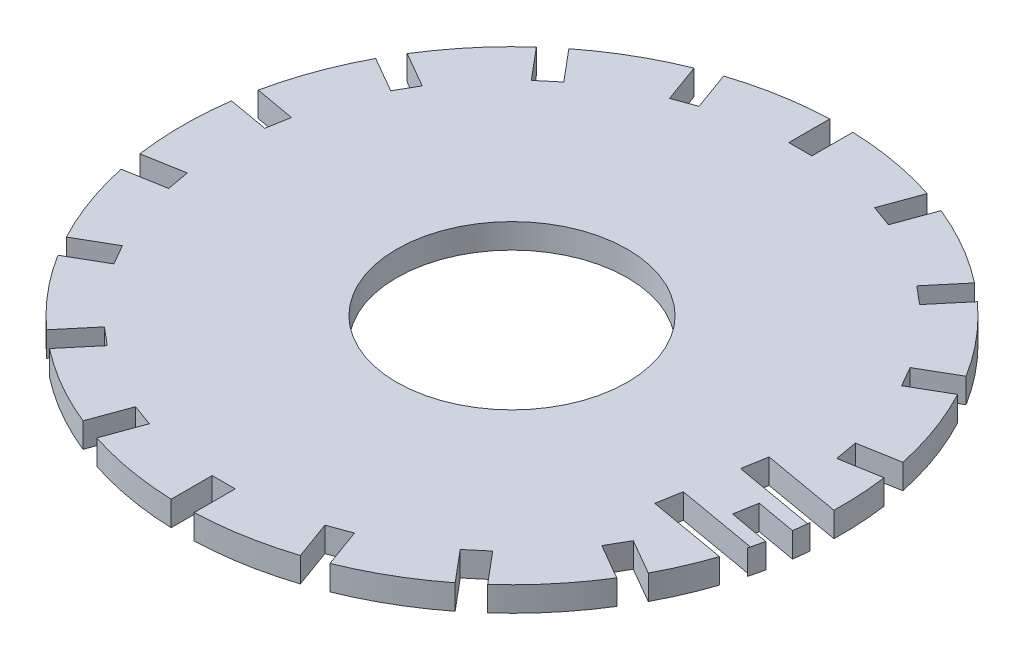
from build123d import *

# Parameters (mm, degrees)
ESQUISSE1_R             = 40
ESQUISSE1_R_2           = 14
BOSS_EXTRU_1_DEPTH      = 3
ENL_V_MAT_EXTRU_1_REACH = 58.648
ESQUISSE2_W             = 2.8
ESQUISSE2_H             = 5
ENL_V_MAT_EXTRU_2_DEPTH = 10


with BuildPart() as part:
    # Esquisse1 → Boss.-Extru.1 (new body)
    with BuildSketch(Plane(origin=(0, 0, 0), x_dir=(1, 0, 0), z_dir=(0, 1, 0))):
        with Locations(Location((0, 0, 0), (0, 0, 270))):
            Circle(ESQUISSE1_R)
        with Locations(Location((0, 0, 0), (0, 0, 270))):
            Circle(ESQUISSE1_R_2, mode=Mode.SUBTRACT)
    extrude(amount=BOSS_EXTRU_1_DEPTH)

    # Esquisse2 → Enlèv. mat.-Extru.1 (cut, up to next)
    with BuildSketch(Plane(origin=(0, 3, 0), x_dir=(1, 0, 0), z_dir=(0, 1, 0)), mode=Mode.PRIVATE) as enl_v_mat_extru_1_sk1:
        Polygon((14.996375402, 37.108876631), (13.286274685, 32.410413527), (10.655135347, 33.368069928), (12.365236064, 38.066533032), align=None)
    enl_v_mat_extru_1_tool1 = extrude(enl_v_mat_extru_1_sk1.sketch, amount=-ENL_V_MAT_EXTRU_1_REACH, mode=Mode.PRIVATE) & part.part
    # Esquisse2 → Enlèv. mat.-Extru.1 (cut, up to next)
    with BuildSketch(Plane(origin=(0, 3, 0), x_dir=(1, 0, 0), z_dir=(0, 1, 0)), mode=Mode.PRIVATE) as enl_v_mat_extru_1_sk2:
        with Locations((0, 37.5)):
            Rectangle(ESQUISSE2_W, ESQUISSE2_H)
    enl_v_mat_extru_1_tool2 = extrude(enl_v_mat_extru_1_sk2.sketch, amount=-ENL_V_MAT_EXTRU_1_REACH, mode=Mode.PRIVATE) & part.part
    # Esquisse2 → Enlèv. mat.-Extru.1 (cut, up to next)
    with BuildSketch(Plane(origin=(0, 3, 0), x_dir=(1, 0, 0), z_dir=(0, 1, 0)), mode=Mode.PRIVATE) as enl_v_mat_extru_1_sk3:
        Polygon((26.783966608, 29.741875071), (23.570028559, 25.911652856), (21.425104119, 27.711458163), (24.639042167, 31.541680378), align=None)
    enl_v_mat_extru_1_tool3 = extrude(enl_v_mat_extru_1_sk3.sketch, amount=-ENL_V_MAT_EXTRU_1_REACH, mode=Mode.PRIVATE) & part.part
    # Esquisse2 → Enlèv. mat.-Extru.1 (cut, up to next)
    with BuildSketch(Plane(origin=(0, 3, 0), x_dir=(1, 0, 0), z_dir=(0, 1, 0)), mode=Mode.PRIVATE) as enl_v_mat_extru_1_sk4:
        Polygon((35.341016151, 18.787564435), (31.010889132, 16.287564435), (29.610889132, 18.712435565), (33.941016151, 21.212435565), align=None)
    enl_v_mat_extru_1_tool4 = extrude(enl_v_mat_extru_1_sk4.sketch, amount=-ENL_V_MAT_EXTRU_1_REACH, mode=Mode.PRIVATE) & part.part
    # Esquisse2 → Enlèv. mat.-Extru.1 (cut, up to next)
    with BuildSketch(Plane(origin=(0, 3, 0), x_dir=(1, 0, 0), z_dir=(0, 1, 0)), mode=Mode.PRIVATE) as enl_v_mat_extru_1_sk5:
        Polygon((39.635417569, 5.567196252), (34.711378804, 4.698955364), (34.225163907, 7.456417073), (39.149202672, 8.324657961), align=None)
    enl_v_mat_extru_1_tool5 = extrude(enl_v_mat_extru_1_sk5.sketch, amount=-ENL_V_MAT_EXTRU_1_REACH, mode=Mode.PRIVATE) & part.part
    # Esquisse2 → Enlèv. mat.-Extru.1 (cut, up to next)
    with BuildSketch(Plane(origin=(0, 3, 0), x_dir=(1, 0, 0), z_dir=(0, 1, 0)), mode=Mode.PRIVATE) as enl_v_mat_extru_1_sk6:
        Polygon((39.149202672, -8.324657961), (34.225163907, -7.456417073), (34.711378804, -4.698955364), (39.635417569, -5.567196252), align=None)
    enl_v_mat_extru_1_tool6 = extrude(enl_v_mat_extru_1_sk6.sketch, amount=-ENL_V_MAT_EXTRU_1_REACH, mode=Mode.PRIVATE) & part.part
    # Esquisse2 → Enlèv. mat.-Extru.1 (cut, up to next)
    with BuildSketch(Plane(origin=(0, 3, 0), x_dir=(1, 0, 0), z_dir=(0, 1, 0)), mode=Mode.PRIVATE) as enl_v_mat_extru_1_sk7:
        Polygon((33.941016151, -21.212435565), (29.610889132, -18.712435565), (31.010889132, -16.287564435), (35.341016151, -18.787564435), align=None)
    enl_v_mat_extru_1_tool7 = extrude(enl_v_mat_extru_1_sk7.sketch, amount=-ENL_V_MAT_EXTRU_1_REACH, mode=Mode.PRIVATE) & part.part
    # Esquisse2 → Enlèv. mat.-Extru.1 (cut, up to next)
    with BuildSketch(Plane(origin=(0, 3, 0), x_dir=(1, 0, 0), z_dir=(0, 1, 0)), mode=Mode.PRIVATE) as enl_v_mat_extru_1_sk8:
        Polygon((24.639042167, -31.541680378), (21.425104119, -27.711458163), (23.570028559, -25.911652856), (26.783966608, -29.741875071), align=None)
    enl_v_mat_extru_1_tool8 = extrude(enl_v_mat_extru_1_sk8.sketch, amount=-ENL_V_MAT_EXTRU_1_REACH, mode=Mode.PRIVATE) & part.part
    # Esquisse2 → Enlèv. mat.-Extru.1 (cut, up to next)
    with BuildSketch(Plane(origin=(0, 3, 0), x_dir=(1, 0, 0), z_dir=(0, 1, 0)), mode=Mode.PRIVATE) as enl_v_mat_extru_1_sk9:
        Polygon((12.365236064, -38.066533032), (10.655135347, -33.368069928), (13.286274686, -32.410413527), (14.996375402, -37.108876631), align=None)
    enl_v_mat_extru_1_tool9 = extrude(enl_v_mat_extru_1_sk9.sketch, amount=-ENL_V_MAT_EXTRU_1_REACH, mode=Mode.PRIVATE) & part.part
    # Esquisse2 → Enlèv. mat.-Extru.1 (cut, up to next)
    with BuildSketch(Plane(origin=(0, 3, 0), x_dir=(1, 0, 0), z_dir=(0, 1, 0)), mode=Mode.PRIVATE) as enl_v_mat_extru_1_sk10:
        with Locations((0, -37.5)):
            Rectangle(ESQUISSE2_W, ESQUISSE2_H)
    enl_v_mat_extru_1_tool10 = extrude(enl_v_mat_extru_1_sk10.sketch, amount=-ENL_V_MAT_EXTRU_1_REACH, mode=Mode.PRIVATE) & part.part
    # Esquisse2 → Enlèv. mat.-Extru.1 (cut, up to next)
    with BuildSketch(Plane(origin=(0, 3, 0), x_dir=(1, 0, 0), z_dir=(0, 1, 0)), mode=Mode.PRIVATE) as enl_v_mat_extru_1_sk11:
        Polygon((-14.996375402, -37.108876631), (-13.286274685, -32.410413527), (-10.655135347, -33.368069928), (-12.365236064, -38.066533032), align=None)
    enl_v_mat_extru_1_tool11 = extrude(enl_v_mat_extru_1_sk11.sketch, amount=-ENL_V_MAT_EXTRU_1_REACH, mode=Mode.PRIVATE) & part.part
    # Esquisse2 → Enlèv. mat.-Extru.1 (cut, up to next)
    with BuildSketch(Plane(origin=(0, 3, 0), x_dir=(1, 0, 0), z_dir=(0, 1, 0)), mode=Mode.PRIVATE) as enl_v_mat_extru_1_sk12:
        Polygon((-26.783966608, -29.741875071), (-23.570028559, -25.911652856), (-21.425104119, -27.711458163), (-24.639042167, -31.541680378), align=None)
    enl_v_mat_extru_1_tool12 = extrude(enl_v_mat_extru_1_sk12.sketch, amount=-ENL_V_MAT_EXTRU_1_REACH, mode=Mode.PRIVATE) & part.part
    # Esquisse2 → Enlèv. mat.-Extru.1 (cut, up to next)
    with BuildSketch(Plane(origin=(0, 3, 0), x_dir=(1, 0, 0), z_dir=(0, 1, 0)), mode=Mode.PRIVATE) as enl_v_mat_extru_1_sk13:
        Polygon((-35.341016151, -18.787564435), (-31.010889132, -16.287564435), (-29.610889132, -18.712435565), (-33.941016151, -21.212435565), align=None)
    enl_v_mat_extru_1_tool13 = extrude(enl_v_mat_extru_1_sk13.sketch, amount=-ENL_V_MAT_EXTRU_1_REACH, mode=Mode.PRIVATE) & part.part
    # Esquisse2 → Enlèv. mat.-Extru.1 (cut, up to next)
    with BuildSketch(Plane(origin=(0, 3, 0), x_dir=(1, 0, 0), z_dir=(0, 1, 0)), mode=Mode.PRIVATE) as enl_v_mat_extru_1_sk14:
        Polygon((-39.635417569, -5.567196252), (-34.711378804, -4.698955364), (-34.225163907, -7.456417073), (-39.149202672, -8.324657961), align=None)
    enl_v_mat_extru_1_tool14 = extrude(enl_v_mat_extru_1_sk14.sketch, amount=-ENL_V_MAT_EXTRU_1_REACH, mode=Mode.PRIVATE) & part.part
    # Esquisse2 → Enlèv. mat.-Extru.1 (cut, up to next)
    with BuildSketch(Plane(origin=(0, 3, 0), x_dir=(1, 0, 0), z_dir=(0, 1, 0)), mode=Mode.PRIVATE) as enl_v_mat_extru_1_sk15:
        Polygon((-39.149202672, 8.324657961), (-34.225163907, 7.456417073), (-34.711378804, 4.698955364), (-39.635417569, 5.567196252), align=None)
    enl_v_mat_extru_1_tool15 = extrude(enl_v_mat_extru_1_sk15.sketch, amount=-ENL_V_MAT_EXTRU_1_REACH, mode=Mode.PRIVATE) & part.part
    # Esquisse2 → Enlèv. mat.-Extru.1 (cut, up to next)
    with BuildSketch(Plane(origin=(0, 3, 0), x_dir=(1, 0, 0), z_dir=(0, 1, 0)), mode=Mode.PRIVATE) as enl_v_mat_extru_1_sk16:
        Polygon((-33.941016151, 21.212435565), (-29.610889132, 18.712435565), (-31.010889132, 16.287564435), (-35.341016151, 18.787564435), align=None)
    enl_v_mat_extru_1_tool16 = extrude(enl_v_mat_extru_1_sk16.sketch, amount=-ENL_V_MAT_EXTRU_1_REACH, mode=Mode.PRIVATE) & part.part
    # Esquisse2 → Enlèv. mat.-Extru.1 (cut, up to next)
    with BuildSketch(Plane(origin=(0, 3, 0), x_dir=(1, 0, 0), z_dir=(0, 1, 0)), mode=Mode.PRIVATE) as enl_v_mat_extru_1_sk17:
        Polygon((-24.639042167, 31.541680378), (-21.425104119, 27.711458163), (-23.570028559, 25.911652856), (-26.783966608, 29.741875071), align=None)
    enl_v_mat_extru_1_tool17 = extrude(enl_v_mat_extru_1_sk17.sketch, amount=-ENL_V_MAT_EXTRU_1_REACH, mode=Mode.PRIVATE) & part.part
    # Esquisse2 → Enlèv. mat.-Extru.1 (cut, up to next)
    with BuildSketch(Plane(origin=(0, 3, 0), x_dir=(1, 0, 0), z_dir=(0, 1, 0)), mode=Mode.PRIVATE) as enl_v_mat_extru_1_sk18:
        Polygon((-12.365236064, 38.066533032), (-10.655135347, 33.368069928), (-13.286274685, 32.410413527), (-14.996375402, 37.108876631), align=None)
    enl_v_mat_extru_1_tool18 = extrude(enl_v_mat_extru_1_sk18.sketch, amount=-ENL_V_MAT_EXTRU_1_REACH, mode=Mode.PRIVATE) & part.part
    add(enl_v_mat_extru_1_tool1.solids().sort_by_distance((12.825755, 3, -35.238473))[0], mode=Mode.SUBTRACT)
    add(enl_v_mat_extru_1_tool2.solids().sort_by_distance((0, 3, -37.5))[0], mode=Mode.SUBTRACT)
    add(enl_v_mat_extru_1_tool3.solids().sort_by_distance((24.104535, 3, -28.726667))[0], mode=Mode.SUBTRACT)
    add(enl_v_mat_extru_1_tool4.solids().sort_by_distance((32.475953, 3, -18.75))[0], mode=Mode.SUBTRACT)
    add(enl_v_mat_extru_1_tool5.solids().sort_by_distance((36.930291, 3, -6.511807))[0], mode=Mode.SUBTRACT)
    add(enl_v_mat_extru_1_tool6.solids().sort_by_distance((36.930291, 3, 6.511807))[0], mode=Mode.SUBTRACT)
    add(enl_v_mat_extru_1_tool7.solids().sort_by_distance((32.475953, 3, 18.75))[0], mode=Mode.SUBTRACT)
    add(enl_v_mat_extru_1_tool8.solids().sort_by_distance((24.104535, 3, 28.726667))[0], mode=Mode.SUBTRACT)
    add(enl_v_mat_extru_1_tool9.solids().sort_by_distance((12.825755, 3, 35.238473))[0], mode=Mode.SUBTRACT)
    add(enl_v_mat_extru_1_tool10.solids().sort_by_distance((0, 3, 37.5))[0], mode=Mode.SUBTRACT)
    add(enl_v_mat_extru_1_tool11.solids().sort_by_distance((-12.825755, 3, 35.238473))[0], mode=Mode.SUBTRACT)
    add(enl_v_mat_extru_1_tool12.solids().sort_by_distance((-24.104535, 3, 28.726667))[0], mode=Mode.SUBTRACT)
    add(enl_v_mat_extru_1_tool13.solids().sort_by_distance((-32.475953, 3, 18.75))[0], mode=Mode.SUBTRACT)
    add(enl_v_mat_extru_1_tool14.solids().sort_by_distance((-36.930291, 3, 6.511807))[0], mode=Mode.SUBTRACT)
    add(enl_v_mat_extru_1_tool15.solids().sort_by_distance((-36.930291, 3, -6.511807))[0], mode=Mode.SUBTRACT)
    add(enl_v_mat_extru_1_tool16.solids().sort_by_distance((-32.475953, 3, -18.75))[0], mode=Mode.SUBTRACT)
    add(enl_v_mat_extru_1_tool17.solids().sort_by_distance((-24.104535, 3, -28.726667))[0], mode=Mode.SUBTRACT)
    add(enl_v_mat_extru_1_tool18.solids().sort_by_distance((-12.825755, 3, -35.238473))[0], mode=Mode.SUBTRACT)

    # Esquisse3 → Enlèv. mat.-Extru.2 (cut)
    with BuildSketch(Plane(origin=(0, 3, 0), x_dir=(1, 0, 0), z_dir=(0, 1, 0))):
        Polygon((30.453325998, 0.760699996), (29.93607291, -2.194371787), (39.786312187, -3.918548747), (40.303565275, -0.963476964), align=None)
        Polygon((28.384313646, -11.059587136), (28.901566734, -8.104515353), (38.751806011, -9.828692313), (38.234552923, -12.783764096), align=None)
    extrude(amount=-ENL_V_MAT_EXTRU_2_DEPTH, mode=Mode.SUBTRACT)


solid = part.part
